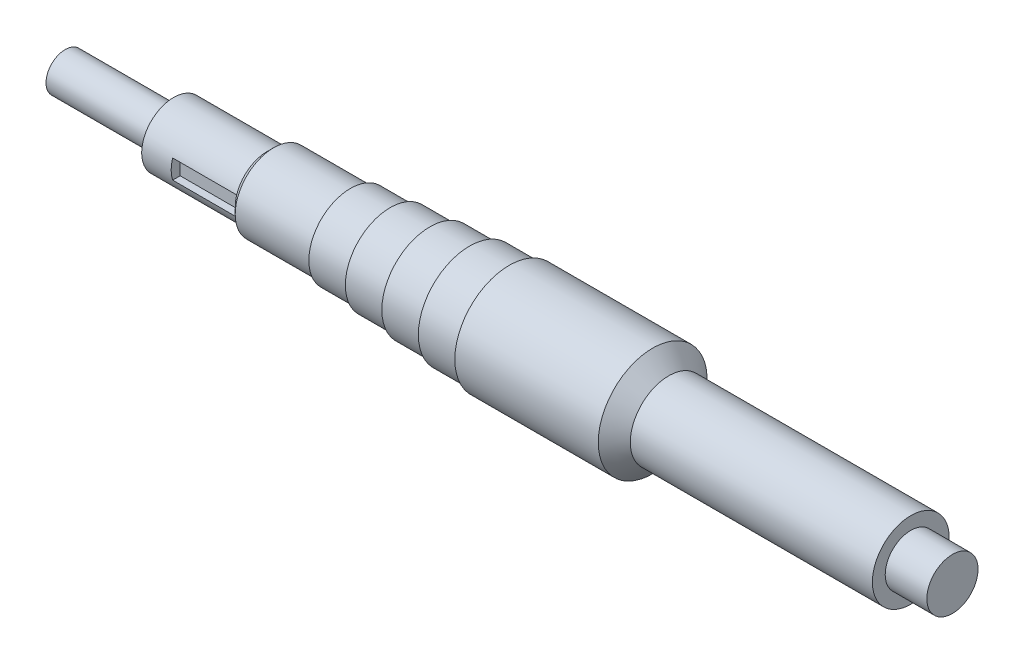
from build123d import *

# Parameters (mm, degrees)
CUT_EXTRUDE1_START = 2
SKETCH2_W          = 10
SKETCH2_H          = 3
CUT_EXTRUDE1_DEPTH = 1.4


with BuildPart() as part:
    # Sketch1 → Revolve1 (revolve)
    with BuildSketch(Plane.XY, mode=Mode.PRIVATE) as revolve1_sk:
        Polygon((0, 0), (0, 3), (6.5, 3), (16.94, 3), (16.94, 5), (21.87, 5), (31.55, 5), (32.55, 6), (44.55, 6), (44.55, 6.5), (50.75, 6.5), (50.75, 7), (56.95, 7), (56.95, 7.5), (63.15, 7.5), (63.15, 8), (69.35, 8), (69.35, 8.5), (91.75, 8.5), (94.25, 6), (120.06, 6), (132.06, 6), (132.06, 4), (138.56, 4), (138.56, 0), align=None)
    revolve(revolve1_sk.sketch.rotate(Axis((0, 0, 0), (1, 0, 0)), 90), axis=Axis((0, 0, 0), (1, 0, 0)))

    # Sketch2 → Cut-Extrude1 (cut)
    with BuildSketch(Plane.XY.offset(3).offset(CUT_EXTRUDE1_START)):
        with Locations((26.55, 0)):
            Rectangle(SKETCH2_W, SKETCH2_H)
    extrude(amount=-CUT_EXTRUDE1_DEPTH, mode=Mode.SUBTRACT)


solid = part.part
